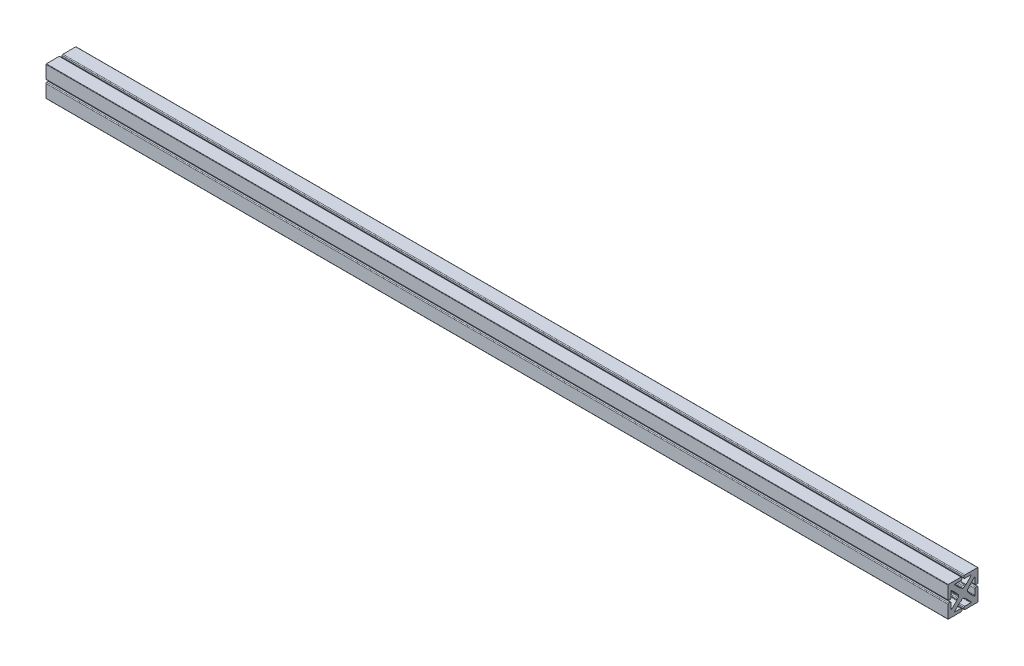
from build123d import *

# Parameters (mm, degrees)
BOSS_EXTRUDE1_DEPTH = 2.54
SCALE1_SCALE        = 8
BOSS_EXTRUDE2_DEPTH = 1200


with BuildPart() as part:
    # Sketch1 → Boss-Extrude1 (new body)
    with BuildSketch(Plane(origin=(0, 0, 0), x_dir=(0, 0, -1), z_dir=(1, 0, 0))):
        with BuildLine():
            Line((-0.2413, 1.4986), (0.2413, 1.4986))
            ThreePointArc((0.2413, 1.4986), (0.420905122, 1.572994878), (0.4953, 1.7526))
            ThreePointArc((0.4953, 1.7526), (0.569694878, 1.932205122), (0.7493, 2.0066))
            Line((0.7493, 2.0066), (0.882498635, 2.0066))
            ThreePointArc((0.882498635, 2.0066), (0.981966313, 2.026886113), (1.065545703, 2.084504086))
            Line((1.065545703, 2.084504086), (2.714118421, 3.798152043))
            ThreePointArc((2.714118421, 3.798152043), (2.739451831, 3.935933839), (2.622594887, 4.0132))
            Line((2.622594887, 4.0132), (0.635, 4.0132))
            ThreePointArc((0.635, 4.0132), (0.455394878, 4.087594878), (0.381, 4.2672))
            Line((0.381, 4.2672), (0.381, 4.7498))
            ThreePointArc((0.381, 4.7498), (0.455394878, 4.929405122), (0.635, 5.0038))
            Line((0.635, 5.0038), (4.8768, 5.0038))
            ThreePointArc((4.8768, 5.0038), (4.966602561, 4.966602561), (5.0038, 4.8768))
            Line((5.0038, 4.8768), (5.0038, 0.635))
            ThreePointArc((5.0038, 0.635), (4.929405122, 0.455394878), (4.7498, 0.381))
            Line((4.7498, 0.381), (4.2672, 0.381))
            ThreePointArc((4.2672, 0.381), (4.087594878, 0.455394878), (4.0132, 0.635))
            Line((4.0132, 0.635), (4.0132, 2.622594887))
            ThreePointArc((4.0132, 2.622594887), (3.935933839, 2.739451831), (3.798152043, 2.714118421))
            Line((3.798152043, 2.714118421), (2.084504086, 1.065545703))
            ThreePointArc((2.084504086, 1.065545703), (2.026886113, 0.981966313), (2.0066, 0.882498635))
            Line((2.0066, 0.882498635), (2.0066, 0.7493))
            ThreePointArc((2.0066, 0.7493), (1.932205122, 0.569694878), (1.7526, 0.4953))
            ThreePointArc((1.7526, 0.4953), (1.572994878, 0.420905122), (1.4986, 0.2413))
            Line((1.4986, 0.2413), (1.4986, -0.2413))
            ThreePointArc((1.4986, -0.2413), (1.572994878, -0.420905122), (1.7526, -0.4953))
            ThreePointArc((1.7526, -0.4953), (1.932205122, -0.569694878), (2.0066, -0.7493))
            Line((2.0066, -0.7493), (2.0066, -0.882498635))
            ThreePointArc((2.0066, -0.882498635), (2.026886113, -0.981966313), (2.084504086, -1.065545703))
            Line((2.084504086, -1.065545703), (3.798152043, -2.714118421))
            ThreePointArc((3.798152043, -2.714118421), (3.935933839, -2.739451831), (4.0132, -2.622594887))
            Line((4.0132, -2.622594887), (4.0132, -0.635))
            ThreePointArc((4.0132, -0.635), (4.087594878, -0.455394878), (4.2672, -0.381))
            Line((4.2672, -0.381), (4.7498, -0.381))
            ThreePointArc((4.7498, -0.381), (4.929405122, -0.455394878), (5.0038, -0.635))
            Line((5.0038, -0.635), (5.0038, -4.8768))
            ThreePointArc((5.0038, -4.8768), (4.966602561, -4.966602561), (4.8768, -5.0038))
            Line((4.8768, -5.0038), (0.635, -5.0038))
            ThreePointArc((0.635, -5.0038), (0.455394878, -4.929405122), (0.381, -4.7498))
            Line((0.381, -4.7498), (0.381, -4.2672))
            ThreePointArc((0.381, -4.2672), (0.455394878, -4.087594878), (0.635, -4.0132))
            Line((0.635, -4.0132), (2.622594887, -4.0132))
            ThreePointArc((2.622594887, -4.0132), (2.739451831, -3.935933839), (2.714118421, -3.798152043))
            Line((2.714118421, -3.798152043), (1.065545703, -2.084504086))
            ThreePointArc((1.065545703, -2.084504086), (0.981966313, -2.026886113), (0.882498635, -2.0066))
            Line((0.882498635, -2.0066), (0.7493, -2.0066))
            ThreePointArc((0.7493, -2.0066), (0.569694878, -1.932205122), (0.4953, -1.7526))
            ThreePointArc((0.4953, -1.7526), (0.420905122, -1.572994878), (0.2413, -1.4986))
            Line((0.2413, -1.4986), (-0.2413, -1.4986))
            ThreePointArc((-0.2413, -1.4986), (-0.420905122, -1.572994878), (-0.4953, -1.7526))
            ThreePointArc((-0.4953, -1.7526), (-0.569694878, -1.932205122), (-0.7493, -2.0066))
            Line((-0.7493, -2.0066), (-0.882498635, -2.0066))
            ThreePointArc((-0.882498635, -2.0066), (-0.981966313, -2.026886113), (-1.065545703, -2.084504086))
            Line((-1.065545703, -2.084504086), (-2.714118421, -3.798152043))
            ThreePointArc((-2.714118421, -3.798152043), (-2.739451831, -3.935933839), (-2.622594887, -4.0132))
            Line((-2.622594887, -4.0132), (-0.635, -4.0132))
            ThreePointArc((-0.635, -4.0132), (-0.455394878, -4.087594878), (-0.381, -4.2672))
            Line((-0.381, -4.2672), (-0.381, -4.7498))
            ThreePointArc((-0.381, -4.7498), (-0.455394878, -4.929405122), (-0.635, -5.0038))
            Line((-0.635, -5.0038), (-4.8768, -5.0038))
            ThreePointArc((-4.8768, -5.0038), (-4.966602561, -4.966602561), (-5.0038, -4.8768))
            Line((-5.0038, -4.8768), (-5.0038, -0.635))
            ThreePointArc((-5.0038, -0.635), (-4.929405122, -0.455394878), (-4.7498, -0.381))
            Line((-4.7498, -0.381), (-4.2672, -0.381))
            ThreePointArc((-4.2672, -0.381), (-4.087594878, -0.455394878), (-4.0132, -0.635))
            Line((-4.0132, -0.635), (-4.0132, -2.622594887))
            ThreePointArc((-4.0132, -2.622594887), (-3.935933839, -2.739451831), (-3.798152043, -2.714118421))
            Line((-3.798152043, -2.714118421), (-2.084504086, -1.065545703))
            ThreePointArc((-2.084504086, -1.065545703), (-2.026886113, -0.981966313), (-2.0066, -0.882498635))
            Line((-2.0066, -0.882498635), (-2.0066, -0.7493))
            ThreePointArc((-2.0066, -0.7493), (-1.932205122, -0.569694878), (-1.7526, -0.4953))
            ThreePointArc((-1.7526, -0.4953), (-1.572994878, -0.420905122), (-1.4986, -0.2413))
            Line((-1.4986, -0.2413), (-1.4986, 0.2413))
            ThreePointArc((-1.4986, 0.2413), (-1.572994878, 0.420905122), (-1.7526, 0.4953))
            ThreePointArc((-1.7526, 0.4953), (-1.932205122, 0.569694878), (-2.0066, 0.7493))
            Line((-2.0066, 0.7493), (-2.0066, 0.882498635))
            ThreePointArc((-2.0066, 0.882498635), (-2.026886113, 0.981966313), (-2.084504086, 1.065545703))
            Line((-2.084504086, 1.065545703), (-3.798152043, 2.714118421))
            ThreePointArc((-3.798152043, 2.714118421), (-3.935933839, 2.739451831), (-4.0132, 2.622594887))
            Line((-4.0132, 2.622594887), (-4.0132, 0.635))
            ThreePointArc((-4.0132, 0.635), (-4.087594878, 0.455394878), (-4.2672, 0.381))
            Line((-4.2672, 0.381), (-4.7498, 0.381))
            ThreePointArc((-4.7498, 0.381), (-4.929405122, 0.455394878), (-5.0038, 0.635))
            Line((-5.0038, 0.635), (-5.0038, 4.8768))
            ThreePointArc((-5.0038, 4.8768), (-4.966602561, 4.966602561), (-4.8768, 5.0038))
            Line((-4.8768, 5.0038), (-0.635, 5.0038))
            ThreePointArc((-0.635, 5.0038), (-0.455394878, 4.929405122), (-0.381, 4.7498))
            Line((-0.381, 4.7498), (-0.381, 4.2672))
            ThreePointArc((-0.381, 4.2672), (-0.455394878, 4.087594878), (-0.635, 4.0132))
            Line((-0.635, 4.0132), (-2.622594887, 4.0132))
            ThreePointArc((-2.622594887, 4.0132), (-2.739451831, 3.935933839), (-2.714118421, 3.798152043))
            Line((-2.714118421, 3.798152043), (-1.065545703, 2.084504086))
            ThreePointArc((-1.065545703, 2.084504086), (-0.981966313, 2.026886113), (-0.882498635, 2.0066))
            Line((-0.882498635, 2.0066), (-0.7493, 2.0066))
            ThreePointArc((-0.7493, 2.0066), (-0.569694878, 1.932205122), (-0.4953, 1.7526))
            ThreePointArc((-0.4953, 1.7526), (-0.420905122, 1.572994878), (-0.2413, 1.4986))
        make_face()
    extrude(amount=BOSS_EXTRUDE1_DEPTH)


with BuildPart() as part_1:
    # Scale1: scaled about (1.27, 0, 0)
    add(part.part.scale(SCALE1_SCALE).moved(Location((-8.89, 0, 0))))

    # Sketch2 → Boss-Extrude2 (add, symmetric)
    with BuildSketch(Plane(origin=(0, 0, 0), x_dir=(0, 0, -1), z_dir=(1, 0, 0))):
        with BuildLine():
            Line((-37.9984, 3.048), (-34.1376, 3.048))
            ThreePointArc((-34.1376, 3.048), (-32.700759021, 3.643159021), (-32.1056, 5.08))
            Line((-32.1056, 5.08), (-32.1056, 20.980759097))
            ThreePointArc((-32.1056, 20.980759097), (-31.487470712, 21.915614646), (-30.385216345, 21.71294737))
            Line((-30.385216345, 21.71294737), (-16.67603269, 8.524365626))
            ThreePointArc((-16.67603269, 8.524365626), (-16.215088903, 7.855730504), (-16.0528, 7.059989081))
            Line((-16.0528, 7.059989081), (-16.0528, 5.9944))
            ThreePointArc((-16.0528, 5.9944), (-15.457640979, 4.557559021), (-14.0208, 3.9624))
            ThreePointArc((-14.0208, 3.9624), (-12.583959021, 3.367240979), (-11.9888, 1.9304))
            Line((-11.9888, 1.9304), (-11.9888, -1.9304))
            ThreePointArc((-11.9888, -1.9304), (-12.583959021, -3.367240979), (-14.0208, -3.9624))
            ThreePointArc((-14.0208, -3.9624), (-15.457640979, -4.557559021), (-16.0528, -5.9944))
            Line((-16.0528, -5.9944), (-16.0528, -7.059989081))
            ThreePointArc((-16.0528, -7.059989081), (-16.215088903, -7.855730504), (-16.67603269, -8.524365626))
            Line((-16.67603269, -8.524365626), (-30.385216345, -21.71294737))
            ThreePointArc((-30.385216345, -21.71294737), (-31.487470712, -21.915614646), (-32.1056, -20.980759097))
            Line((-32.1056, -20.980759097), (-32.1056, -5.08))
            ThreePointArc((-32.1056, -5.08), (-32.700759021, -3.643159021), (-34.1376, -3.048))
            Line((-34.1376, -3.048), (-37.9984, -3.048))
            ThreePointArc((-37.9984, -3.048), (-39.435240979, -3.643159021), (-40.0304, -5.08))
            Line((-40.0304, -5.08), (-40.0304, -39.0144))
            ThreePointArc((-40.0304, -39.0144), (-39.73282049, -39.73282049), (-39.0144, -40.0304))
            Line((-39.0144, -40.0304), (-5.08, -40.0304))
            ThreePointArc((-5.08, -40.0304), (-3.643159021, -39.435240979), (-3.048, -37.9984))
            Line((-3.048, -37.9984), (-3.048, -34.1376))
            ThreePointArc((-3.048, -34.1376), (-3.643159021, -32.700759021), (-5.08, -32.1056))
            Line((-5.08, -32.1056), (-20.980759097, -32.1056))
            ThreePointArc((-20.980759097, -32.1056), (-21.915614646, -31.487470712), (-21.71294737, -30.385216345))
            Line((-21.71294737, -30.385216345), (-8.524365626, -16.67603269))
            ThreePointArc((-8.524365626, -16.67603269), (-7.855730504, -16.215088903), (-7.059989081, -16.0528))
            Line((-7.059989081, -16.0528), (-5.9944, -16.0528))
            ThreePointArc((-5.9944, -16.0528), (-4.557559021, -15.457640979), (-3.9624, -14.0208))
            ThreePointArc((-3.9624, -14.0208), (-3.367240979, -12.583959021), (-1.9304, -11.9888))
            Line((-1.9304, -11.9888), (1.9304, -11.9888))
            ThreePointArc((1.9304, -11.9888), (3.367240979, -12.583959021), (3.9624, -14.0208))
            ThreePointArc((3.9624, -14.0208), (4.557559021, -15.457640979), (5.9944, -16.0528))
            Line((5.9944, -16.0528), (7.059989081, -16.0528))
            ThreePointArc((7.059989081, -16.0528), (7.855730504, -16.215088903), (8.524365626, -16.67603269))
            Line((8.524365626, -16.67603269), (21.71294737, -30.385216345))
            ThreePointArc((21.71294737, -30.385216345), (21.915614646, -31.487470712), (20.980759097, -32.1056))
            Line((20.980759097, -32.1056), (5.08, -32.1056))
            ThreePointArc((5.08, -32.1056), (3.643159021, -32.700759021), (3.048, -34.1376))
            Line((3.048, -34.1376), (3.048, -37.9984))
            ThreePointArc((3.048, -37.9984), (3.643159021, -39.435240979), (5.08, -40.0304))
            Line((5.08, -40.0304), (39.0144, -40.0304))
            ThreePointArc((39.0144, -40.0304), (39.73282049, -39.73282049), (40.0304, -39.0144))
            Line((40.0304, -39.0144), (40.0304, -5.08))
            ThreePointArc((40.0304, -5.08), (39.435240979, -3.643159021), (37.9984, -3.048))
            Line((37.9984, -3.048), (34.1376, -3.048))
            ThreePointArc((34.1376, -3.048), (32.700759021, -3.643159021), (32.1056, -5.08))
            Line((32.1056, -5.08), (32.1056, -20.980759097))
            ThreePointArc((32.1056, -20.980759097), (31.487470712, -21.915614646), (30.385216345, -21.71294737))
            Line((30.385216345, -21.71294737), (16.67603269, -8.524365626))
            ThreePointArc((16.67603269, -8.524365626), (16.215088903, -7.855730504), (16.0528, -7.059989081))
            Line((16.0528, -7.059989081), (16.0528, -5.9944))
            ThreePointArc((16.0528, -5.9944), (15.457640979, -4.557559021), (14.0208, -3.9624))
            ThreePointArc((14.0208, -3.9624), (12.583959021, -3.367240979), (11.9888, -1.9304))
            Line((11.9888, -1.9304), (11.9888, 1.9304))
            ThreePointArc((11.9888, 1.9304), (12.583959021, 3.367240979), (14.0208, 3.9624))
            ThreePointArc((14.0208, 3.9624), (15.457640979, 4.557559021), (16.0528, 5.9944))
            Line((16.0528, 5.9944), (16.0528, 7.059989081))
            ThreePointArc((16.0528, 7.059989081), (16.215088903, 7.855730504), (16.67603269, 8.524365626))
            Line((16.67603269, 8.524365626), (30.385216345, 21.71294737))
            ThreePointArc((30.385216345, 21.71294737), (31.487470712, 21.915614646), (32.1056, 20.980759097))
            Line((32.1056, 20.980759097), (32.1056, 5.08))
            ThreePointArc((32.1056, 5.08), (32.700759021, 3.643159021), (34.1376, 3.048))
            Line((34.1376, 3.048), (37.9984, 3.048))
            ThreePointArc((37.9984, 3.048), (39.435240979, 3.643159021), (40.0304, 5.08))
            Line((40.0304, 5.08), (40.0304, 39.0144))
            ThreePointArc((40.0304, 39.0144), (39.73282049, 39.73282049), (39.0144, 40.0304))
            Line((39.0144, 40.0304), (5.08, 40.0304))
            ThreePointArc((5.08, 40.0304), (3.643159021, 39.435240979), (3.048, 37.9984))
            Line((3.048, 37.9984), (3.048, 34.1376))
            ThreePointArc((3.048, 34.1376), (3.643159021, 32.700759021), (5.08, 32.1056))
            Line((5.08, 32.1056), (20.980759097, 32.1056))
            ThreePointArc((20.980759097, 32.1056), (21.915614646, 31.487470712), (21.71294737, 30.385216345))
            Line((21.71294737, 30.385216345), (8.524365626, 16.67603269))
            ThreePointArc((8.524365626, 16.67603269), (7.855730504, 16.215088903), (7.059989081, 16.0528))
            Line((7.059989081, 16.0528), (5.9944, 16.0528))
            ThreePointArc((5.9944, 16.0528), (4.557559021, 15.457640979), (3.9624, 14.0208))
            ThreePointArc((3.9624, 14.0208), (3.367240979, 12.583959021), (1.9304, 11.9888))
            Line((1.9304, 11.9888), (-1.9304, 11.9888))
            ThreePointArc((-1.9304, 11.9888), (-3.367240979, 12.583959021), (-3.9624, 14.0208))
            ThreePointArc((-3.9624, 14.0208), (-4.557559021, 15.457640979), (-5.9944, 16.0528))
            Line((-5.9944, 16.0528), (-7.059989081, 16.0528))
            ThreePointArc((-7.059989081, 16.0528), (-7.855730504, 16.215088903), (-8.524365626, 16.67603269))
            Line((-8.524365626, 16.67603269), (-21.71294737, 30.385216345))
            ThreePointArc((-21.71294737, 30.385216345), (-21.915614646, 31.487470712), (-20.980759097, 32.1056))
            Line((-20.980759097, 32.1056), (-5.08, 32.1056))
            ThreePointArc((-5.08, 32.1056), (-3.643159021, 32.700759021), (-3.048, 34.1376))
            Line((-3.048, 34.1376), (-3.048, 37.9984))
            ThreePointArc((-3.048, 37.9984), (-3.643159021, 39.435240979), (-5.08, 40.0304))
            Line((-5.08, 40.0304), (-39.0144, 40.0304))
            ThreePointArc((-39.0144, 40.0304), (-39.73282049, 39.73282049), (-40.0304, 39.0144))
            Line((-40.0304, 39.0144), (-40.0304, 5.08))
            ThreePointArc((-40.0304, 5.08), (-39.435240979, 3.643159021), (-37.9984, 3.048))
        make_face()
    extrude(amount=BOSS_EXTRUDE2_DEPTH, both=True)


solid = part_1.part
